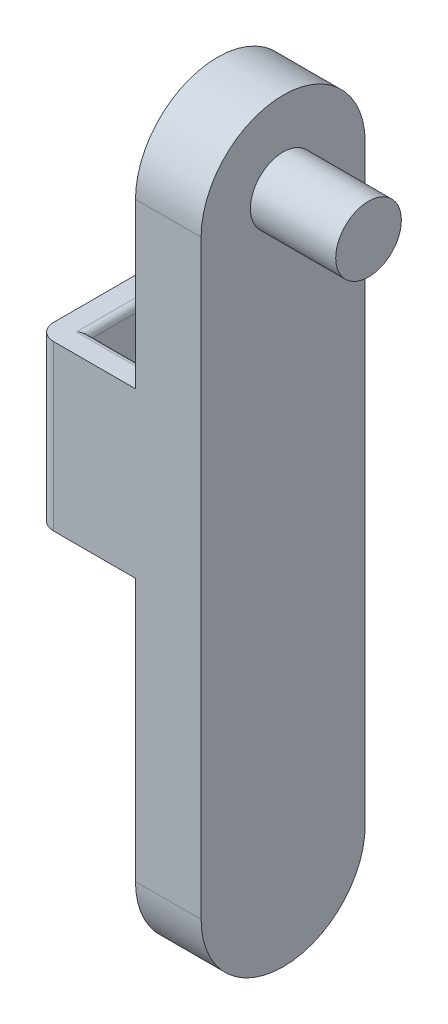
from build123d import *

# Parameters (mm, degrees)
BOSS_EXTRUDE1_DEPTH = 2
SKETCH2_R           = 1
BOSS_EXTRUDE2_DEPTH = 2.6
SKETCH3_W           = 3
SKETCH3_H           = 5
BOSS_EXTRUDE3_DEPTH = 5
SKETCH4_W           = 1.4
SKETCH4_H           = 3.4
CUT_EXTRUDE1_DEPTH  = 24.631588809
FILLET1_R           = 0.5
FILLET2_R           = 0.2


with BuildPart() as part:
    # Sketch1 → Boss-Extrude1 (new body)
    with BuildSketch(Plane(origin=(0, 0, 0), x_dir=(0, 0, -1), z_dir=(1, 0, 0))):
        with BuildLine():
            Line((-17.23490614, 15.515536013), (-17.23490614, -2.484463987))
            ThreePointArc((-17.23490614, -2.484463987), (-14.73490614, -4.984463987), (-12.23490614, -2.484463987))
            Line((-12.23490614, -2.484463987), (-12.23490614, 15.515536013))
            ThreePointArc((-12.23490614, 15.515536013), (-14.73490614, 18.015536013), (-17.23490614, 15.515536013))
        make_face()
    extrude(amount=BOSS_EXTRUDE1_DEPTH)

    # Sketch2 → Boss-Extrude2 (add)
    with BuildSketch(Plane(origin=(2, 0, 0), x_dir=(0, 0, -1), z_dir=(1, 0, 0))):
        with Locations(Location((-14.73490614, 15.515536013, 0), (0, 0, 180))):
            Circle(SKETCH2_R)
    extrude(amount=BOSS_EXTRUDE2_DEPTH)

    # Sketch3 → Boss-Extrude3 (add)
    with BuildSketch(Plane(origin=(0, 0, 12.23490614), x_dir=(-1, 0, 0), z_dir=(0, 0, -1))):
        with Locations((1.5, 8.015536013)):
            Rectangle(SKETCH3_W, SKETCH3_H)
    extrude(amount=-BOSS_EXTRUDE3_DEPTH)

    # Sketch4 → Cut-Extrude1 (cut, through all)
    with BuildSketch(Plane(origin=(0, 10.515536013, 0), x_dir=(1, 0, 0), z_dir=(0, 1, 0))):
        with Locations((-1.5, -14.73490614)):
            Rectangle(SKETCH4_W, SKETCH4_H)
    extrude(amount=-CUT_EXTRUDE1_DEPTH, mode=Mode.SUBTRACT)

    # Fillet1
    fillet1_edges = [part.edges().sort_by_distance(p)[0] for p in [
        (-3, 8.015536013, 12.23490614),
        (-3, 8.015536013, 17.23490614),
    ]]
    fillet(fillet1_edges, radius=FILLET1_R)

    # Fillet2
    fillet2_edges = [part.edges().sort_by_distance(p)[0] for p in [
        (-1.5, 5.515536013, 13.03490614),
        (-2.2, 5.515536013, 14.73490614),
        (-1.5, 5.515536013, 16.43490614),
        (-0.8, 5.515536013, 14.73490614),
        (-0.8, 10.515536013, 14.73490614),
        (-1.5, 10.515536013, 13.03490614),
        (-2.2, 10.515536013, 14.73490614),
        (-1.5, 10.515536013, 16.43490614),
    ]]
    fillet(fillet2_edges, radius=FILLET2_R)


solid = part.part
